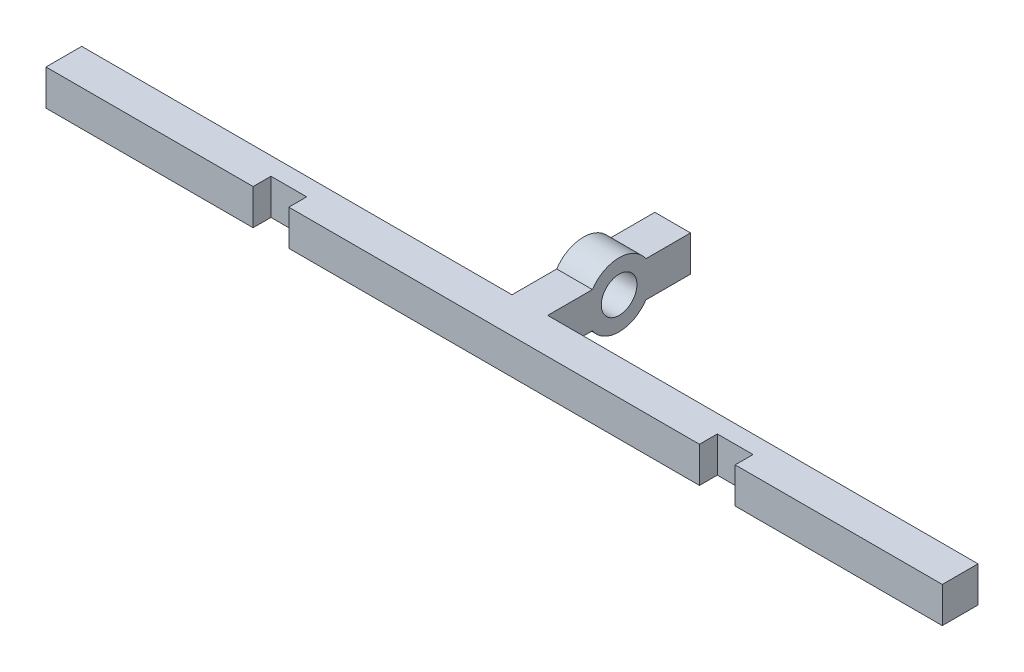
from build123d import *

# Parameters (mm, degrees)
SKETCH1_W           = 251
SKETCH1_H           = 10
BOSS_EXTRUDE1_DEPTH = 10
SKETCH2_W           = 10
SKETCH2_H           = 10
CUT_EXTRUDE1_DEPTH  = 5
SKETCH4_W           = 10
SKETCH4_H           = 10
BOSS_EXTRUDE2_DEPTH = 40
CUT_EXTRUDE2_REACH  = 138.859
SKETCH5_R           = 5
SKETCH7_R           = 9
SKETCH7_R_2         = 5
BOSS_EXTRUDE3_DEPTH = 10


with BuildPart() as part:
    # Sketch1 → Boss-Extrude1 (new body)
    with BuildSketch(Plane.XY):
        with Locations((-125.5, 5)):
            Rectangle(SKETCH1_W, SKETCH1_H)
    extrude(amount=BOSS_EXTRUDE1_DEPTH)

    # Sketch2 → Cut-Extrude1 (cut)
    with BuildSketch(Plane.XY.offset(10)):
        with Locations((-188, 5)):
            Rectangle(SKETCH2_W, SKETCH2_H)
        with Locations((-63, 5)):
            Rectangle(SKETCH2_W, SKETCH2_H)
    extrude(amount=-CUT_EXTRUDE1_DEPTH, mode=Mode.SUBTRACT)

    # Sketch4 → Boss-Extrude2 (add)
    with BuildSketch(Plane(origin=(0, 0, 0), x_dir=(-1, 0, 0), z_dir=(0, 0, -1))):
        with Locations((125.5, 5)):
            Rectangle(SKETCH4_W, SKETCH4_H)
    extrude(amount=BOSS_EXTRUDE2_DEPTH)

    # Sketch5 → Cut-Extrude2 (cut, up to next)
    with BuildSketch(Plane.ZY.offset(130.5), mode=Mode.PRIVATE) as cut_extrude2_sk1:
        with Locations((-20, 5)):
            Circle(SKETCH5_R)
    cut_extrude2_tool1 = extrude(cut_extrude2_sk1.sketch, amount=-CUT_EXTRUDE2_REACH, mode=Mode.PRIVATE) & part.part
    add(cut_extrude2_tool1.solids().sort_by_distance((-130.5, 5, -20))[0], mode=Mode.SUBTRACT)


with BuildPart() as cut_extrude2_piece_1:
    # of the separate pieces the step leaves, piece 1, a body of its own (cut_extrude2_pieces)
    add(part.part.solids().sort_by_distance((0, 0, 0))[0])



with BuildPart() as cut_extrude2_piece_2:
    # of the separate pieces the step leaves, piece 2, a body of its own (cut_extrude2_pieces)
    add(part.part.solids().sort_by_distance((-120.5, 0, -40))[0])


with BuildPart() as cut_extrude2_piece_1_1:
    add(cut_extrude2_piece_1.part)

    add(cut_extrude2_piece_2.part)  # Boss-Extrude3 merges Cut-Extrude2 piece 2
    # Sketch7 → Boss-Extrude3 (add)
    with BuildSketch(Plane.ZY.offset(130.5)):
        with Locations((-20, 5)):
            Circle(SKETCH7_R)
        with Locations((-20, 5)):
            Circle(SKETCH7_R_2, mode=Mode.SUBTRACT)
    extrude(amount=-BOSS_EXTRUDE3_DEPTH)


solid = cut_extrude2_piece_1_1.part
